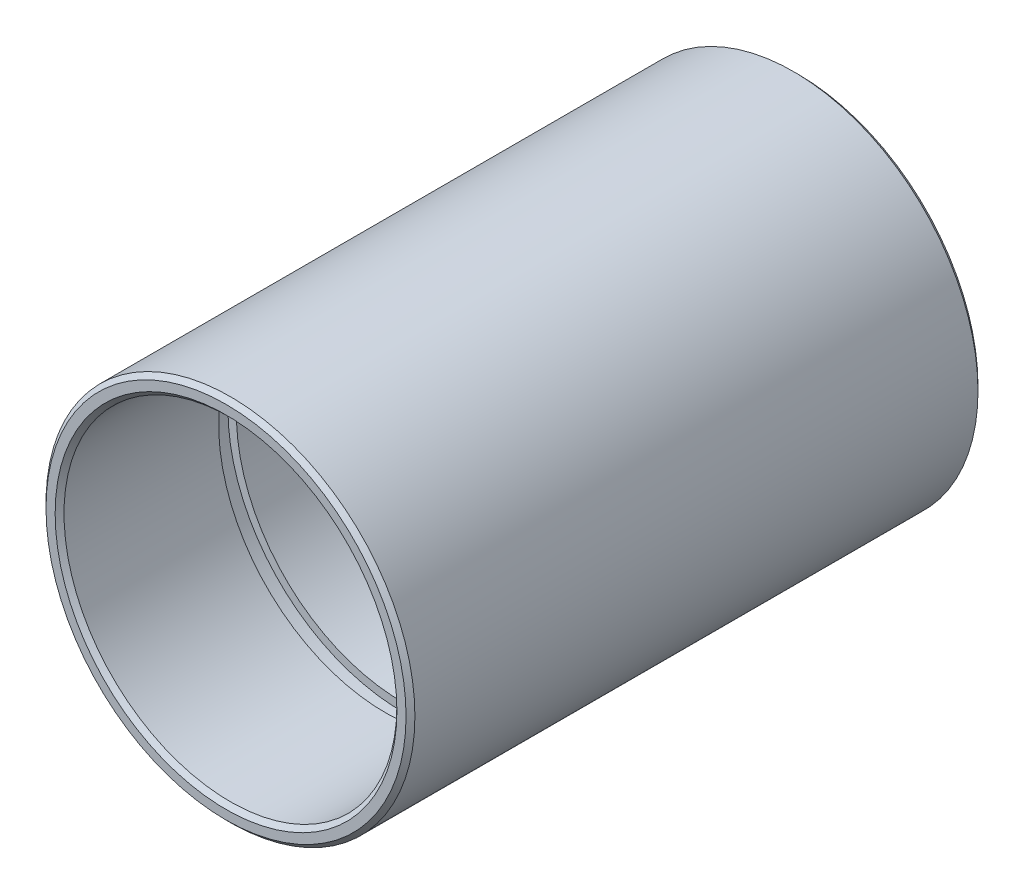
from build123d import *

# Parameters (mm, degrees)
SKETCH1_R          = 15.875
SKETCH1_R_2        = 14.3256
BASE_EXTRUDE_DEPTH = 49.2252
CHAMFER1_SIZE      = 0.381
SKETCH2_R          = 15.0495
CUT_EXTRUDE1_DEPTH = 1.524
CUT_EXTRUDE2_START = 1.524
SKETCH3_R          = 15.0495
CUT_EXTRUDE2_DEPTH = 1.524


with BuildPart() as part:
    # Sketch1 → Base-Extrude (new body)
    with BuildSketch(Plane.XY):
        Circle(SKETCH1_R)
        Circle(SKETCH1_R_2, mode=Mode.SUBTRACT)
    extrude(amount=BASE_EXTRUDE_DEPTH)

    # Chamfer1
    chamfer1_edges = [part.edges().sort_by_distance(p)[0] for p in [
        (-15.875, 0, 0),
        (-15.875, 0, 49.2252),
        (-14.3256, 0, 0),
        (-14.3256, 0, 49.2252),
    ]]
    chamfer(chamfer1_edges, length=CHAMFER1_SIZE)

    # Sketch2 → Cut-Extrude1 (cut)
    with BuildSketch(Plane.XY.offset(15.2146)):
        Circle(SKETCH2_R)
    extrude(amount=-CUT_EXTRUDE1_DEPTH, mode=Mode.SUBTRACT)

    # Sketch3 → Cut-Extrude2 (cut)
    with BuildSketch(Plane.XY.offset(34.0106).offset(CUT_EXTRUDE2_START)):
        Circle(SKETCH3_R)
    extrude(amount=-CUT_EXTRUDE2_DEPTH, mode=Mode.SUBTRACT)


solid = part.part
